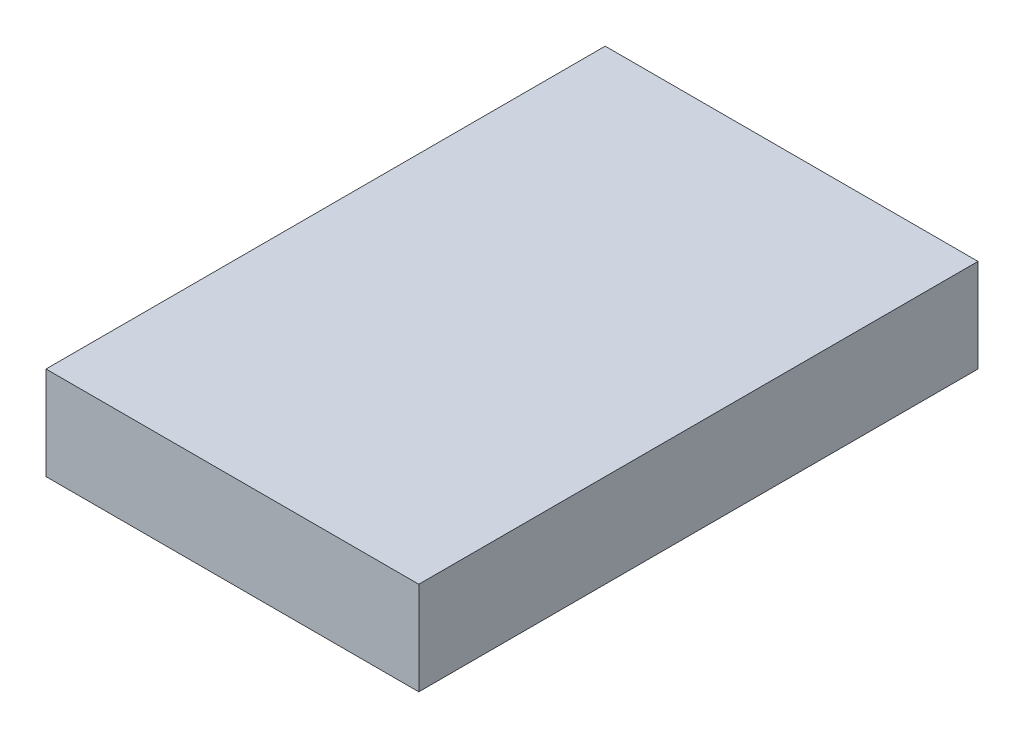
from build123d import *

# Parameters (mm, degrees)
SKETCH1_W           = 20
SKETCH1_H           = 30
BOSS_EXTRUDE1_DEPTH = 5


with BuildPart() as part:
    # Sketch1 → Boss-Extrude1 (new body)
    with BuildSketch(Plane(origin=(0, 0, 0), x_dir=(1, 0, 0), z_dir=(0, 1, 0))):
        Rectangle(SKETCH1_W, SKETCH1_H)
    extrude(amount=BOSS_EXTRUDE1_DEPTH)


solid = part.part
